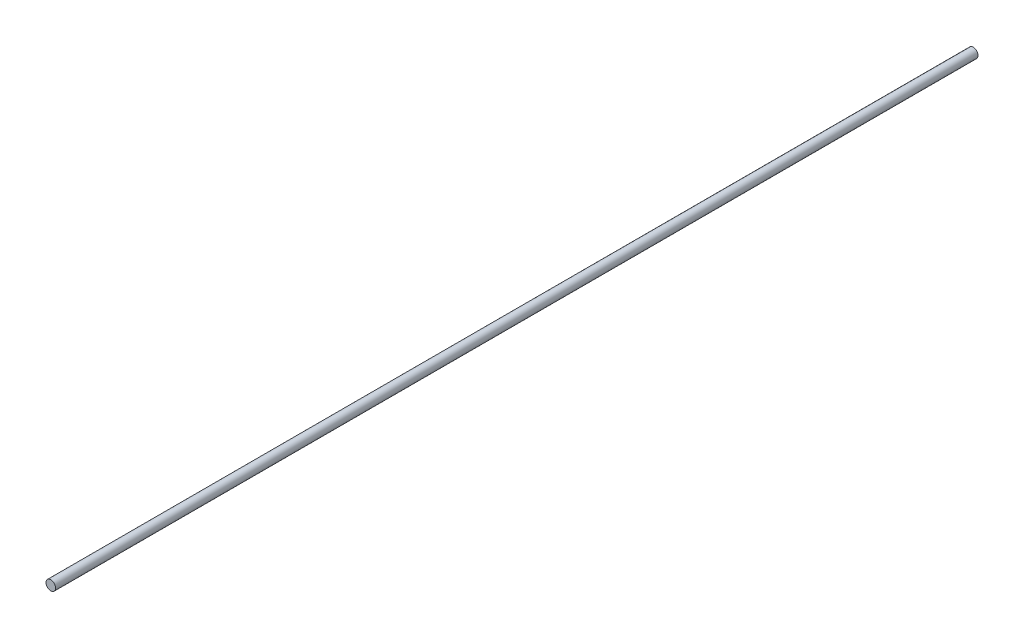
from build123d import *

# Parameters (mm, degrees)
BOSS_EXTRUDE1_DEPTH      = 457.2
BOSS_EXTRUDE1_DEPTH_BACK = 457.2
SKETCH3_R                = 4.7625


with BuildPart() as part:
    # Sketch3 → Boss-Extrude1 (new, two sides: drawn at the far end of the back side and taken through both)
    with BuildSketch(Plane.XY.offset(-BOSS_EXTRUDE1_DEPTH_BACK)):
        with Locations(Location((0, 0, 0), (0, 0, 180))):
            Circle(SKETCH3_R)
    extrude(amount=BOSS_EXTRUDE1_DEPTH + BOSS_EXTRUDE1_DEPTH_BACK)


solid = part.part
